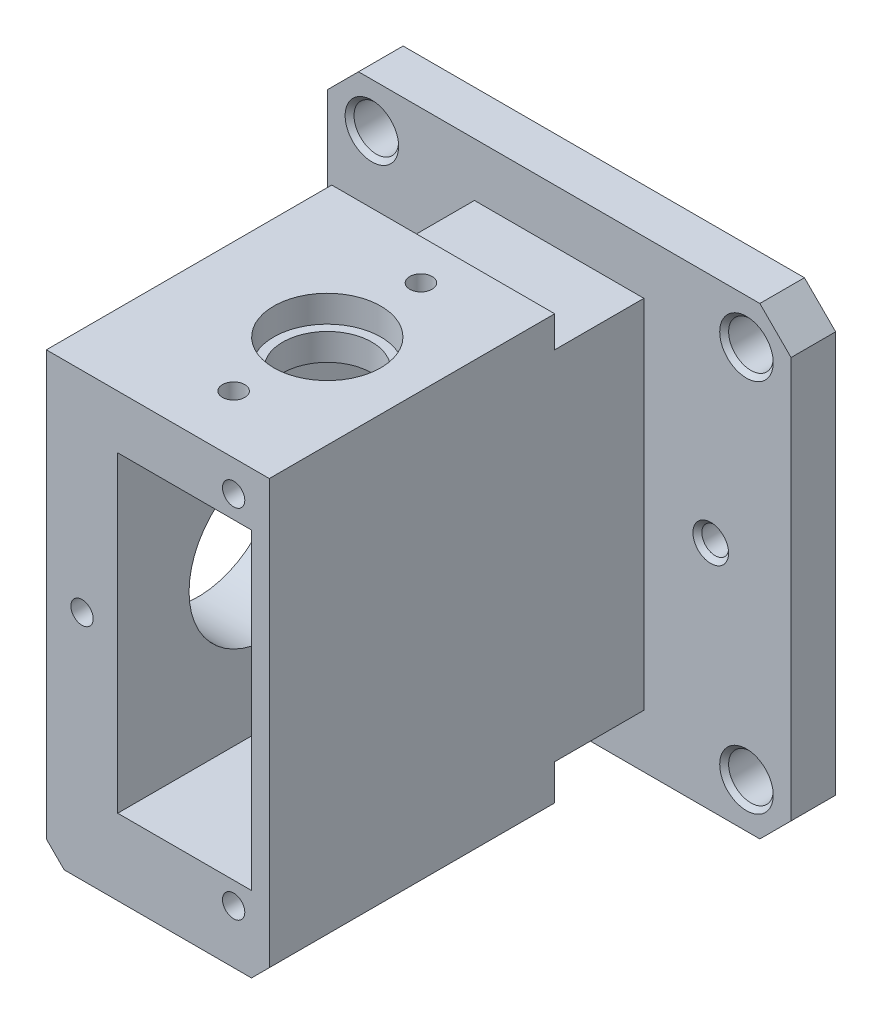
from build123d import *

# Parameters (mm, degrees)
SKETCH_1_W          = 52
SKETCH_1_H          = 52
EXTRUDE_1_DEPTH     = 5
CUT_EXTRUDE_1_DEPTH = 38.107950631
CHAMFER_1_SIZE      = 3.5
CHAMFER_2_SIZE      = 0.5
SKETCH_3_W          = 19
SKETCH_3_H          = 40
EXTRUDE_2_DEPTH     = 42
SKETCH_4_W          = 25
SKETCH_4_H          = 52
EXTRUDE_3_DEPTH     = 32
SKETCH_6_W          = 15
SKETCH_6_H          = 35
CUT_EXTRUDE_2_DEPTH = 60.674114991
CUT_EXTRUDE_3_REACH = 69.877
SKETCH_7_R          = 9
M3X0_51_D           = 2.5
M3X0_51_DEPTH       = 5.5
M3X0_51_TIP         = 0.751075774
CHAMFER_3_SIZE      = 2
M3X0_52_D           = 2.5
M3X0_52_DEPTH       = 5.5
M3X0_52_TIP         = 0.751075774
SKETCH_13_R         = 3.1
CUT_EXTRUDE_4_DEPTH = 7
CUT_EXTRUDE_5_REACH = 72.071
SKETCH_14_R         = 2.05
CHAMFER_4_SIZE      = 1
SKETCH_15_W         = 25
SKETCH_15_H         = 32
CUT_EXTRUDE_6_DEPTH = 2.5
SKETCH_16_R         = 6
CUT_EXTRUDE_7_DEPTH = 3
CUT_EXTRUDE_8_REACH = 73.044
SKETCH_17_R         = 5
M3X0_53_D           = 2.5
M3X0_53_DEPTH       = 4.5
M3X0_53_TIP         = 0.751075774
CUT_EXTRUDE_9_REACH = 61.674
SKETCH_20_R         = 1.5
CHAMFER_5_SIZE      = 0.5


with BuildPart() as part:
    # Эскиз1 → Бобышка-Вытянуть1 (new body)
    with BuildSketch(Plane.XY):
        Rectangle(SKETCH_1_W, SKETCH_1_H)
    extrude(amount=EXTRUDE_1_DEPTH)

    # Эскиз2 → Вырез-Вытянуть1 (cut, through all)
    with BuildSketch(Plane.XY.offset(5)):
        with BuildLine():
            ThreePointArc((-18.5, 21), (-22.767766953, 22.767766953), (-21, 18.5))
            Line((-21, 18.5), (-21, 21))
            Line((-21, 21), (-18.5, 21))
        make_face()
        with BuildLine():
            Line((-21, 21), (-21, 18.5))
            ThreePointArc((-21, 18.5), (-19.232233047, 19.232233047), (-18.5, 21))
            Line((-18.5, 21), (-21, 21))
        make_face()
        with BuildLine():
            ThreePointArc((18.5, 21), (19.232233047, 19.232233047), (21, 18.5))
            Line((21, 18.5), (21, 21))
            Line((21, 21), (18.5, 21))
        make_face()
        with BuildLine():
            Line((21, 21), (21, 18.5))
            ThreePointArc((21, 18.5), (22.767766953, 19.232233047), (23.5, 21))
            ThreePointArc((23.5, 21), (21, 23.5), (18.5, 21))
            Line((18.5, 21), (21, 21))
        make_face()
        with BuildLine():
            Line((-21, -18.5), (-21, -21))
            Line((-21, -21), (-18.5, -21))
            ThreePointArc((-18.5, -21), (-19.232233047, -19.232233047), (-21, -18.5))
        make_face()
        with BuildLine():
            Line((-18.5, -21), (-21, -21))
            Line((-21, -21), (-21, -18.5))
            ThreePointArc((-21, -18.5), (-22.767766953, -22.767766953), (-18.5, -21))
        make_face()
        with BuildLine():
            ThreePointArc((21, -18.5), (19.232233047, -19.232233047), (18.5, -21))
            Line((18.5, -21), (21, -21))
            Line((21, -21), (21, -18.5))
        make_face()
        with BuildLine():
            Line((21, -21), (18.5, -21))
            ThreePointArc((18.5, -21), (21, -23.5), (23.5, -21))
            ThreePointArc((23.5, -21), (22.767766953, -19.232233047), (21, -18.5))
            Line((21, -18.5), (21, -21))
        make_face()
    extrude(amount=-CUT_EXTRUDE_1_DEPTH, mode=Mode.SUBTRACT)

    # Фаска1
    chamfer_1_edges = [part.edges().sort_by_distance(p)[0] for p in [
        (26, -26, 2.5),
        (-26, -26, 2.5),
        (-26, 26, 2.5),
        (26, 26, 2.5),
    ]]
    chamfer(chamfer_1_edges, length=CHAMFER_1_SIZE)

    # Фаска2
    chamfer_2_edges = [part.edges().sort_by_distance(p)[0] for p in [
        (23.5, 21, 5),
        (-21, 23.5, 5),
        (-23.5, -21, 5),
        (18.5, -21, 5),
    ]]
    chamfer(chamfer_2_edges, length=CHAMFER_2_SIZE)

    # Эскиз3 → Бобышка-Вытянуть2 (add)
    with BuildSketch(Plane.XY.offset(5)):
        Rectangle(SKETCH_3_W, SKETCH_3_H)
    extrude(amount=EXTRUDE_2_DEPTH)

    # Эскиз4 → Бобышка-Вытянуть3 (add)
    with BuildSketch(Plane.XY.offset(47)):
        with Locations((-3, 0)):
            Rectangle(SKETCH_4_W, SKETCH_4_H)
    extrude(amount=-EXTRUDE_3_DEPTH)

    # Эскиз6 → Вырез-Вытянуть2 (cut, through all)
    with BuildSketch(Plane.XY.offset(47)):
        Rectangle(SKETCH_6_W, SKETCH_6_H)
    extrude(amount=-CUT_EXTRUDE_2_DEPTH, mode=Mode.SUBTRACT)

    # Эскиз7 → Вырез-Вытянуть3 (cut, up to next)
    with BuildSketch(Plane.ZY.offset(15.5), mode=Mode.PRIVATE) as cut_extrude_3_sk1:
        with Locations((30, 0)):
            Circle(SKETCH_7_R)
    cut_extrude_3_tool1 = extrude(cut_extrude_3_sk1.sketch, amount=-CUT_EXTRUDE_3_REACH, mode=Mode.PRIVATE) & part.part
    add(cut_extrude_3_tool1.solids().sort_by_distance((-15.5, 0, 30))[0], mode=Mode.SUBTRACT)

    # Отверстие обработанное метчиком M3x0.51
    with Locations(Plane(origin=(-15.5, 11, 39), x_dir=(0, 0, -1), z_dir=(-1, 0, 0))):
        with Locations((0, 0), (0, 22), (18, 22), (18, 0)):
            Hole(M3X0_51_D / 2, depth=M3X0_51_DEPTH)
            with Locations((0, 0, -(M3X0_51_DEPTH + M3X0_51_TIP / 2))):  # 118° drill point
                Cone(0, M3X0_51_D / 2, M3X0_51_TIP, mode=Mode.SUBTRACT)

    # Фаска3
    chamfer_3_edges = [part.edges().sort_by_distance(p)[0] for p in [
        (9.5, 26, 31),
        (9.5, -26, 31),
        (-15.5, -26, 31),
        (-15.5, 26, 31),
    ]]
    chamfer(chamfer_3_edges, length=CHAMFER_3_SIZE)

    # Отверстие обработанное метчиком M3x0.52
    with Locations(Plane(origin=(5.5, 20, 47), x_dir=(1, 0, 0), z_dir=(0, 0, 1))):
        with Locations((0, 0), (-17, -20), (0, -40)):
            Hole(M3X0_52_D / 2, depth=M3X0_52_DEPTH)
            with Locations((0, 0, -(M3X0_52_DEPTH + M3X0_52_TIP / 2))):  # 118° drill point
                Cone(0, M3X0_52_D / 2, M3X0_52_TIP, mode=Mode.SUBTRACT)

    # Эскиз13 → Вырез-Вытянуть4 (cut)
    with BuildSketch(Plane(origin=(0, -26, 0), x_dir=(-1, 0, 0), z_dir=(0, -1, 0))):
        with Locations(Location((1, -30, 0), (0, 0, 90))):
            Circle(SKETCH_13_R)
    extrude(amount=-CUT_EXTRUDE_4_DEPTH, mode=Mode.SUBTRACT)

    # Эскиз14 → Вырез-Вытянуть5 (cut, up to next)
    with BuildSketch(Plane.XZ.offset(19), mode=Mode.PRIVATE) as cut_extrude_5_sk1:
        with Locations(Location((-1, 30, 0), (0, 0, 270))):
            Circle(SKETCH_14_R)
    cut_extrude_5_tool1 = extrude(cut_extrude_5_sk1.sketch, amount=-CUT_EXTRUDE_5_REACH, mode=Mode.PRIVATE) & part.part
    add(cut_extrude_5_tool1.solids().sort_by_distance((-1, -19, 30))[0], mode=Mode.SUBTRACT)

    # Фаска4
    chamfer_4_edges = [part.edges().sort_by_distance(p)[0] for p in [
        (-1, -26, 33.1),
    ]]
    chamfer(chamfer_4_edges, length=CHAMFER_4_SIZE)

    # Эскиз15 → Вырез-Вытянуть6 (cut)
    with BuildSketch(Plane(origin=(0, 26, 0), x_dir=(1, 0, 0), z_dir=(0, 1, 0))):
        with Locations((-3, -31)):
            Rectangle(SKETCH_15_W, SKETCH_15_H)
    extrude(amount=-CUT_EXTRUDE_6_DEPTH, mode=Mode.SUBTRACT)

    # Эскиз16 → Вырез-Вытянуть7 (cut)
    with BuildSketch(Plane(origin=(0, 23.5, 0), x_dir=(1, 0, 0), z_dir=(0, 1, 0))):
        with Locations(Location((-1, -30, 0), (0, 0, 270))):
            Circle(SKETCH_16_R)
    extrude(amount=-CUT_EXTRUDE_7_DEPTH, mode=Mode.SUBTRACT)

    # Эскиз17 → Вырез-Вытянуть8 (cut, up to next)
    with BuildSketch(Plane(origin=(0, 20.5, 0), x_dir=(1, 0, 0), z_dir=(0, 1, 0)), mode=Mode.PRIVATE) as cut_extrude_8_sk1:
        with Locations(Location((-1, -30, 0), (0, 0, 270))):
            Circle(SKETCH_17_R)
    cut_extrude_8_tool1 = extrude(cut_extrude_8_sk1.sketch, amount=-CUT_EXTRUDE_8_REACH, mode=Mode.PRIVATE) & part.part
    add(cut_extrude_8_tool1.solids().sort_by_distance((-1, 20.5, 30))[0], mode=Mode.SUBTRACT)

    # Отверстие обработанное метчиком M3x0.53
    with Locations(Plane(origin=(-1, 23.5, 40.5), x_dir=(0, 0, 1), z_dir=(0, 1, 0))):
        with Locations((0, 0), (-21, 0)):
            Hole(M3X0_53_D / 2, depth=M3X0_53_DEPTH)
            with Locations((0, 0, -(M3X0_53_DEPTH + M3X0_53_TIP / 2))):  # 118° drill point
                Cone(0, M3X0_53_D / 2, M3X0_53_TIP, mode=Mode.SUBTRACT)

    # Эскиз20 → Вырез-Вытянуть9 (cut, up to next)
    with BuildSketch(Plane(origin=(0, 0, 0), x_dir=(-1, 0, 0), z_dir=(0, 0, -1)), mode=Mode.PRIVATE) as cut_extrude_9_sk1:
        with Locations((-17, 0)):
            Circle(SKETCH_20_R)
    cut_extrude_9_tool1 = extrude(cut_extrude_9_sk1.sketch, amount=-CUT_EXTRUDE_9_REACH, mode=Mode.PRIVATE) & part.part
    # Эскиз20 → Вырез-Вытянуть9 (cut, up to next)
    with BuildSketch(Plane(origin=(0, 0, 0), x_dir=(-1, 0, 0), z_dir=(0, 0, -1)), mode=Mode.PRIVATE) as cut_extrude_9_sk2:
        with Locations((17, 0)):
            Circle(SKETCH_20_R)
    cut_extrude_9_tool2 = extrude(cut_extrude_9_sk2.sketch, amount=-CUT_EXTRUDE_9_REACH, mode=Mode.PRIVATE) & part.part
    add(cut_extrude_9_tool1.solids().sort_by_distance((17, 0, 0))[0], mode=Mode.SUBTRACT)
    add(cut_extrude_9_tool2.solids().sort_by_distance((-17, 0, 0))[0], mode=Mode.SUBTRACT)

    # Фаска5
    chamfer_5_edges = [part.edges().sort_by_distance(p)[0] for p in [
        (18.5, 0, 5),
        (-15.5, 0, 5),
    ]]
    chamfer(chamfer_5_edges, length=CHAMFER_5_SIZE)


solid = part.part
